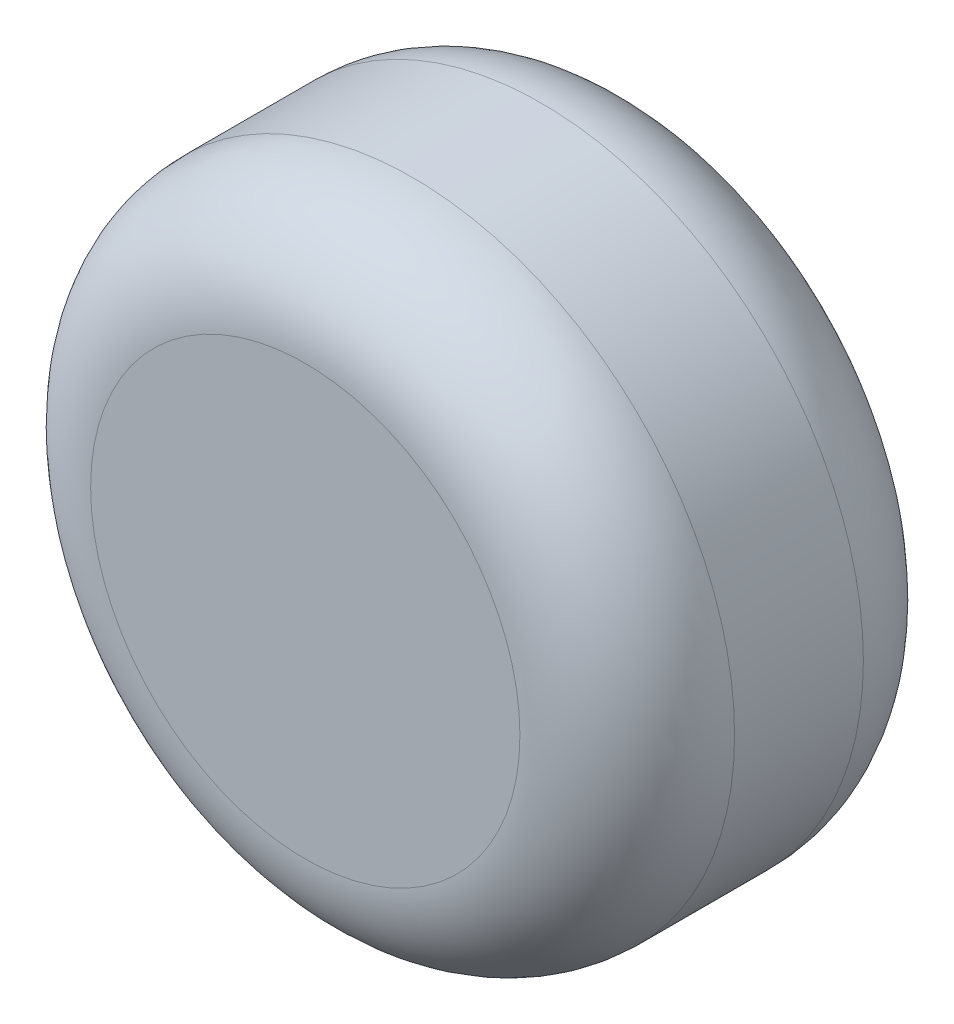
from build123d import *

# Parameters (mm, degrees)
SKETCH_1_R      = 30
EXTRUDE_1_DEPTH = 32
FILLET_1_R      = 10
SKETCH_2_R      = 5
EXTRUDE_2_DEPTH = 12


with BuildPart() as part:
    # Эскиз1 → Бобышка-Вытянуть1 (new body)
    with BuildSketch(Plane.XY):
        Circle(SKETCH_1_R)
    extrude(amount=EXTRUDE_1_DEPTH)

    # Скругление1
    fillet_1_edges = [part.edges().sort_by_distance(p)[0] for p in [
        (-30, 0, 0),
        (-30, 0, 32),
    ]]
    fillet(fillet_1_edges, radius=FILLET_1_R)

    # Эскиз2 → Бобышка-Вытянуть2 (add)
    with BuildSketch(Plane(origin=(0, 0, 0), x_dir=(-1, 0, 0), z_dir=(0, 0, -1))):
        with Locations(Location((0, 0, 0), (0, 0, 180))):
            Circle(SKETCH_2_R)
        with BuildLine():
            Line((-1.198957881, 2.75), (1.198957881, 2.75))
            ThreePointArc((1.198957881, 2.75), (3, 0), (1.198957881, -2.75))
            Line((1.198957881, -2.75), (-1.198957881, -2.75))
            ThreePointArc((-1.198957881, -2.75), (-3, 0), (-1.198957881, 2.75))
        make_face(mode=Mode.SUBTRACT)
    extrude(amount=EXTRUDE_2_DEPTH)


solid = part.part
